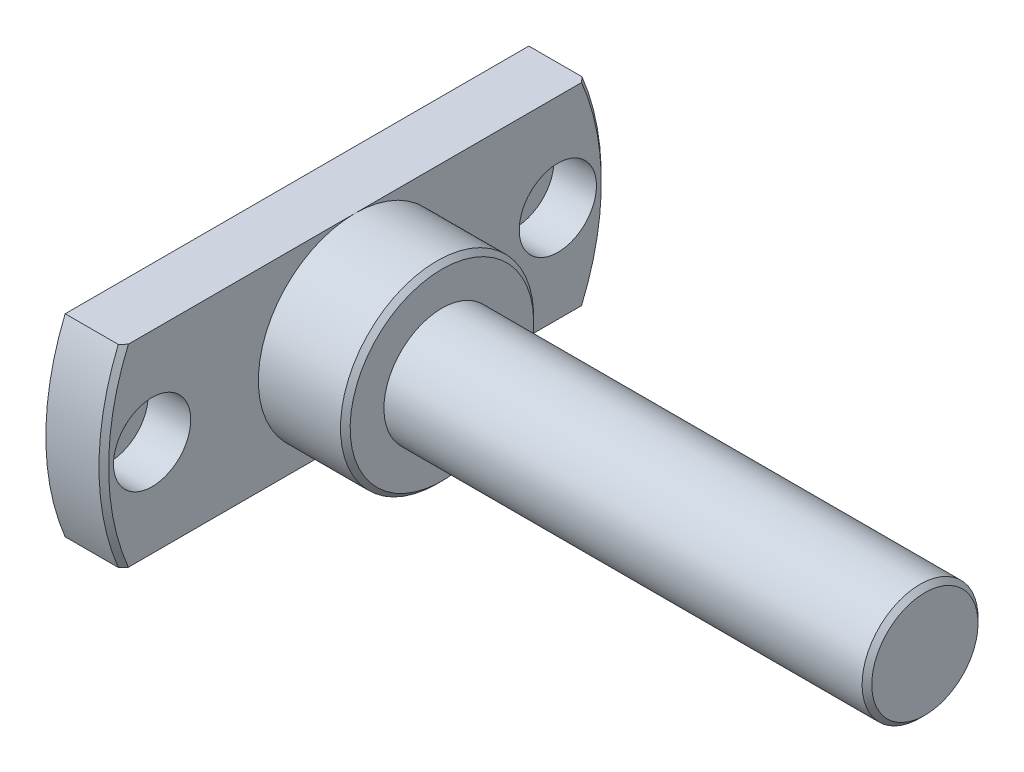
from build123d import *

# Parameters (mm, degrees)
CHANFREIN1_SIZE                                    = 0.5
CHAMBRAGE_POUR_VIS_T_TE_HEXAGONALE_M41_D           = 4.5
CHAMBRAGE_POUR_VIS_T_TE_HEXAGONALE_M41_CBORE_D     = 8
CHAMBRAGE_POUR_VIS_T_TE_HEXAGONALE_M41_CBORE_DEPTH = 4.4
ENL_V_MAT_EXTRU_2_DEPTH                            = 75.679314405
CHANFREIN3_SIZE                                    = 0.5


with BuildPart() as part:
    # Esquisse1 → Révolution1 (revolve)
    with BuildSketch(Plane.XY):
        Polygon((15, 6), (65, 6), (65, 0), (0, 0), (0, 26), (6, 26), (6, 10), (15, 10), align=None)
    revolve(axis=Axis((65, 0, 0), (-1, 0, 0)))

    # Chanfrein1
    chanfrein1_edges = [part.edges().sort_by_distance(p)[0] for p in [
        (6, -26, 0),
        (15, -10, 0),
    ]]
    chamfer(chanfrein1_edges, length=CHANFREIN1_SIZE)

    # Chambrage pour vis à tête hexagonale M41 (through all)
    with Locations(Plane(origin=(6, 0, 0), x_dir=(0, 0, -1), z_dir=(1, 0, 0))):
        with Locations((-21, 0), (21, 0)):
            CounterBoreHole(CHAMBRAGE_POUR_VIS_T_TE_HEXAGONALE_M41_D / 2, CHAMBRAGE_POUR_VIS_T_TE_HEXAGONALE_M41_CBORE_D / 2, CHAMBRAGE_POUR_VIS_T_TE_HEXAGONALE_M41_CBORE_DEPTH)

    # Esquisse11 → Enlèv. mat.-Extru.2 (cut, through all)
    with BuildSketch(Plane.ZY):
        with BuildLine():
            Line((24, -10), (-24, -10))
            ThreePointArc((-24, -10), (0, -26), (24, -10))
        make_face()
        with BuildLine():
            Line((24, 10), (-24, 10))
            ThreePointArc((-24, 10), (0, 26), (24, 10))
        make_face()
    extrude(amount=-ENL_V_MAT_EXTRU_2_DEPTH, mode=Mode.SUBTRACT)

    # Chanfrein3
    chanfrein3_edges = [part.edges().sort_by_distance(p)[0] for p in [
        (65, -6, 0),
    ]]
    chamfer(chanfrein3_edges, length=CHANFREIN3_SIZE)


solid = part.part
